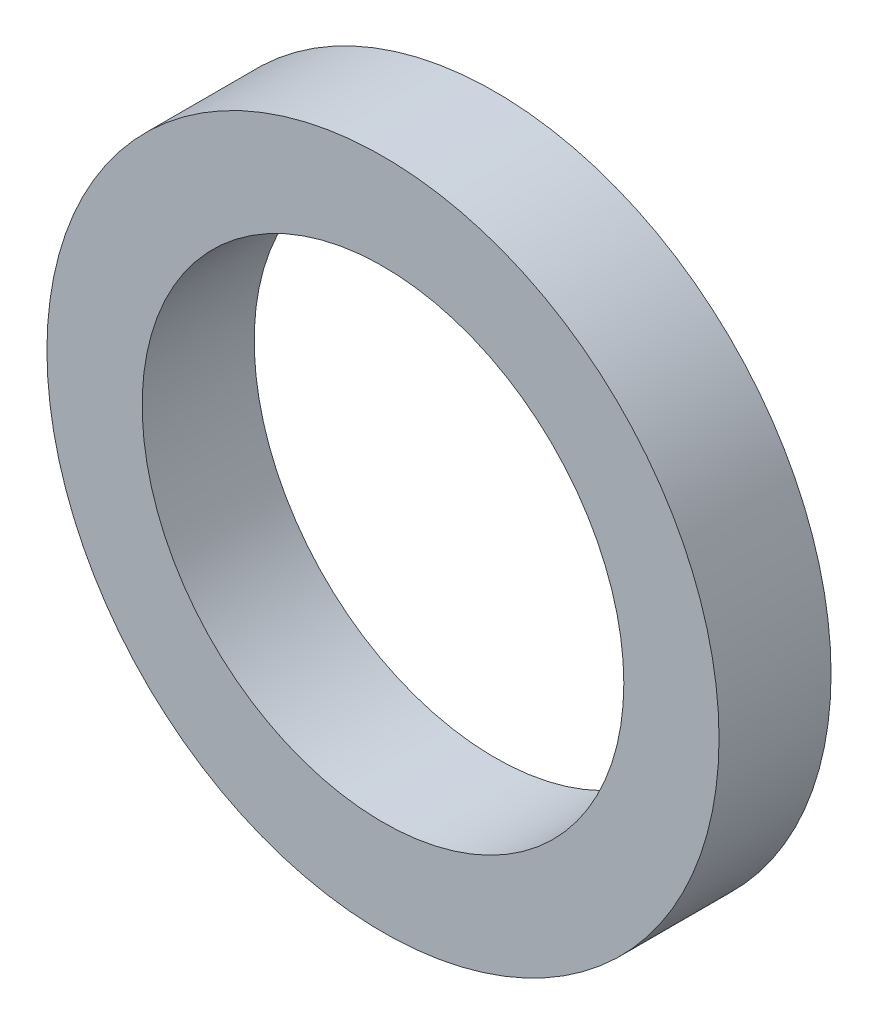
from build123d import *

# Parameters (mm, degrees)
BOSS_EXTRUDE1_DEPTH      = 0.5
BOSS_EXTRUDE1_DEPTH_BACK = 0.5
SKETCH3_R                = 3
SKETCH3_R_2              = 2.15


with BuildPart() as part:
    # Sketch3 → Boss-Extrude1 (new, two sides: drawn at the far end of the back side and taken through both)
    with BuildSketch(Plane.XY.offset(-BOSS_EXTRUDE1_DEPTH_BACK)):
        Circle(SKETCH3_R)
        Circle(SKETCH3_R_2, mode=Mode.SUBTRACT)
    extrude(amount=BOSS_EXTRUDE1_DEPTH + BOSS_EXTRUDE1_DEPTH_BACK)


solid = part.part
